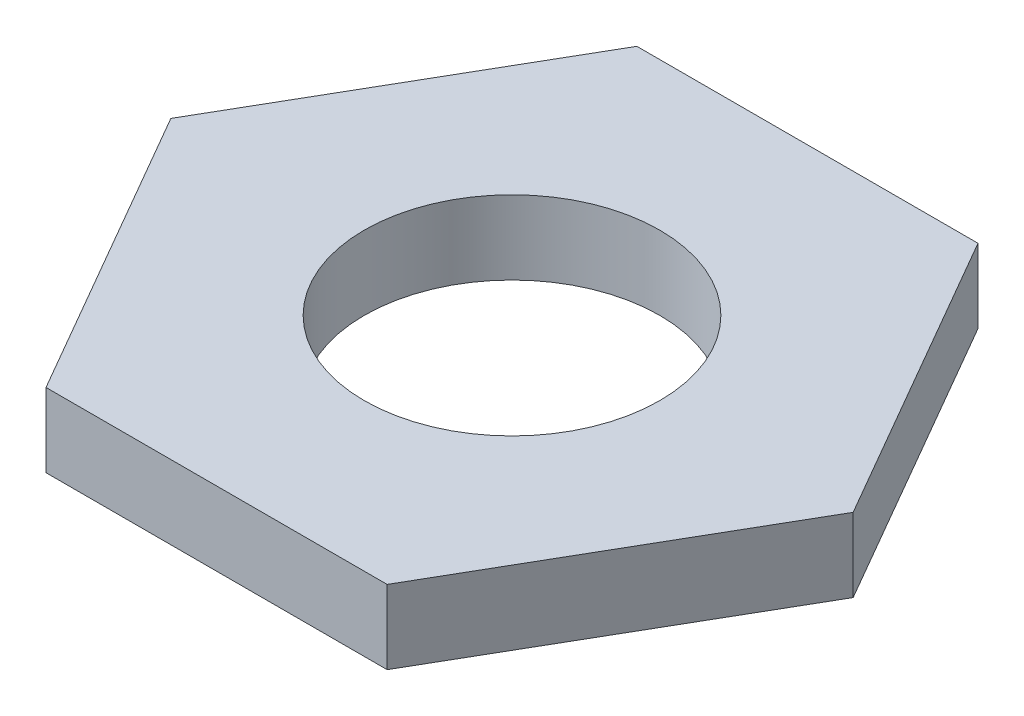
from build123d import *

# Parameters (mm, degrees)
SKETCH1_R           = 2
BOSS_EXTRUDE1_DEPTH = 1


with BuildPart() as part:
    # Sketch1 → Boss-Extrude1 (new body)
    with BuildSketch(Plane(origin=(0, 0, 0), x_dir=(1, 0, 0), z_dir=(0, 1, 0))):
        Polygon((2.309401077, 4), (-2.309401077, 4), (-4.618802154, 0), (-2.309401077, -4), (2.309401077, -4), (4.618802154, 0), align=None)
        with Locations(Location((0, 0, 0), (0, 0, 270))):
            Circle(SKETCH1_R, mode=Mode.SUBTRACT)
    extrude(amount=BOSS_EXTRUDE1_DEPTH)


solid = part.part
